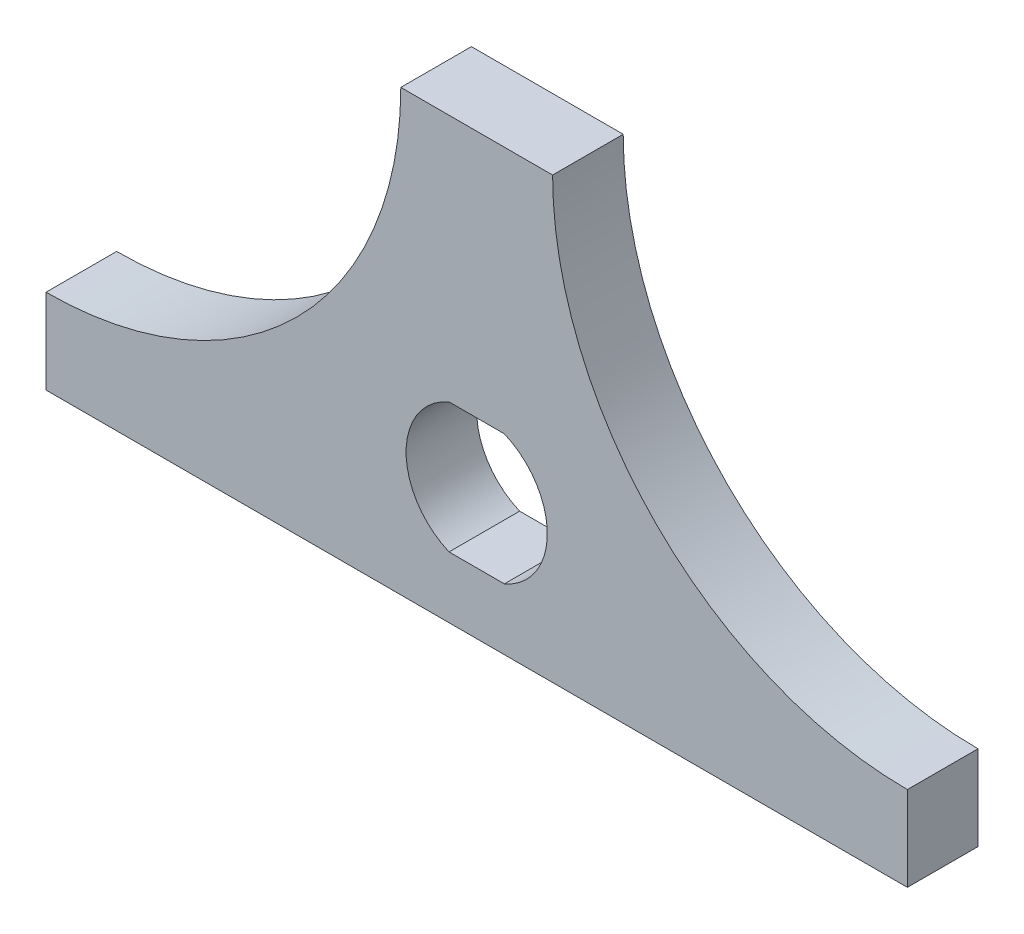
from build123d import *

# Parameters (mm, degrees)
SKETCH1_W           = 129.563097232
SKETCH1_H           = 81.098705598
BOSS_EXTRUDE1_DEPTH = 6.35
SKETCH2_R           = 6.35
CUT_EXTRUDE1_DEPTH  = 77.689122785
SKETCH4_OUTSIDE_W   = 162.16
SKETCH4_OUTSIDE_H   = 113.694
CUT_EXTRUDE2_DEPTH  = 77.689122785
SKETCH6_W           = 4.977363158
SKETCH6_H           = 1.27
BOSS_EXTRUDE2_DEPTH = 6.35


with BuildPart() as part:
    # Sketch1 → Boss-Extrude1 (new body)
    with BuildSketch(Plane.XY):
        Rectangle(SKETCH1_W, SKETCH1_H)
    extrude(amount=BOSS_EXTRUDE1_DEPTH)

    # Sketch2 → Cut-Extrude1 (cut, through all)
    with BuildSketch(Plane.XY.offset(6.35)):
        Circle(SKETCH2_R)
    extrude(amount=-CUT_EXTRUDE1_DEPTH, mode=Mode.SUBTRACT)

    # Sketch4 outside → Cut-Extrude2 (cut, through all)
    with BuildSketch(Plane.XY.offset(6.35)):
        Rectangle(SKETCH4_OUTSIDE_W, SKETCH4_OUTSIDE_H)
        with BuildLine():
            Line((-38.735, -11.358813087), (38.735, -11.358813087))
            Line((38.735, -11.358813087), (38.735, -3.738813087))
            ThreePointArc((38.735, -3.738813087), (16.172106496, 5.607043409), (6.82625, 28.169936913))
            Line((6.82625, 28.169936913), (-6.82625, 28.169936913))
            ThreePointArc((-6.82625, 28.169936913), (-16.172106496, 5.607043409), (-38.735, -3.738813087))
            Line((-38.735, -3.738813087), (-38.735, -11.358813087))
        make_face(mode=Mode.SUBTRACT)
    extrude(amount=-CUT_EXTRUDE2_DEPTH, mode=Mode.SUBTRACT)

    # Sketch6 → Boss-Extrude2 (add)
    with BuildSketch(Plane.XY.offset(6.35)):
        with Locations((0, 6.477)):
            Rectangle(SKETCH6_W, SKETCH6_H)
    boss_extrude2 = extrude(amount=-BOSS_EXTRUDE2_DEPTH)

    # Mirror1: Boss-Extrude2 across plane
    add(boss_extrude2.mirror(Plane.ZX))


solid = part.part
